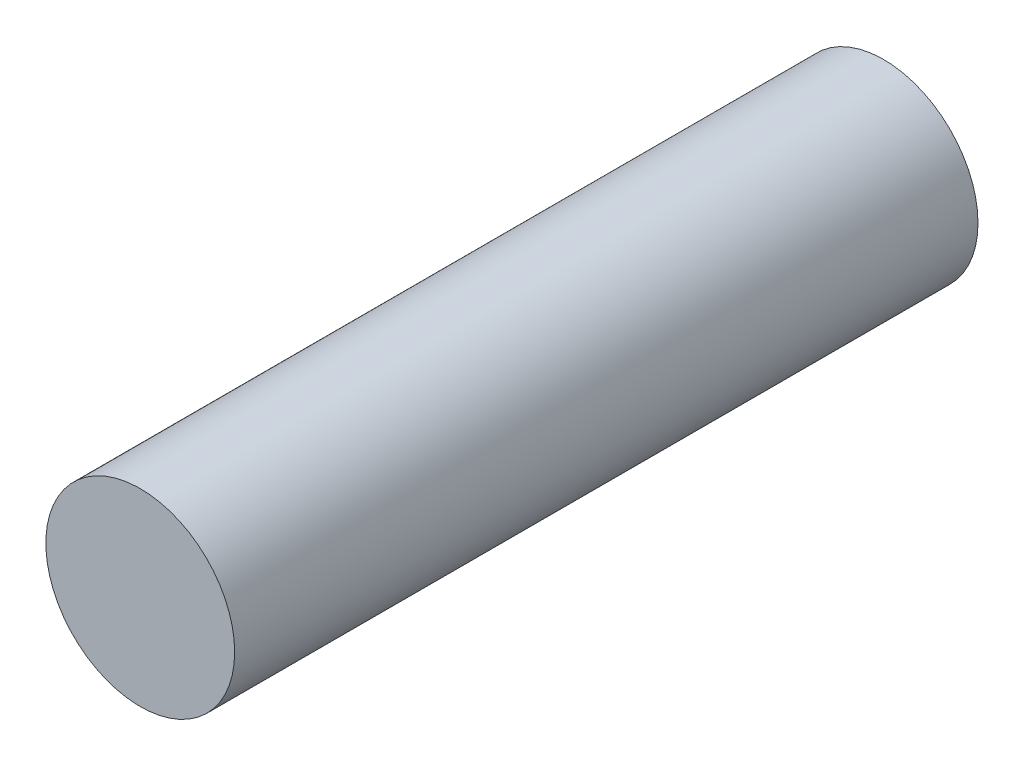
from build123d import *

# Parameters (mm, degrees)
SKETCH1_R           = 12.7
BOSS_EXTRUDE1_DEPTH = 100


with BuildPart() as part:
    # Sketch1 → Boss-Extrude1 (new body)
    with BuildSketch(Plane.XY):
        Circle(SKETCH1_R)
    extrude(amount=BOSS_EXTRUDE1_DEPTH)


solid = part.part
